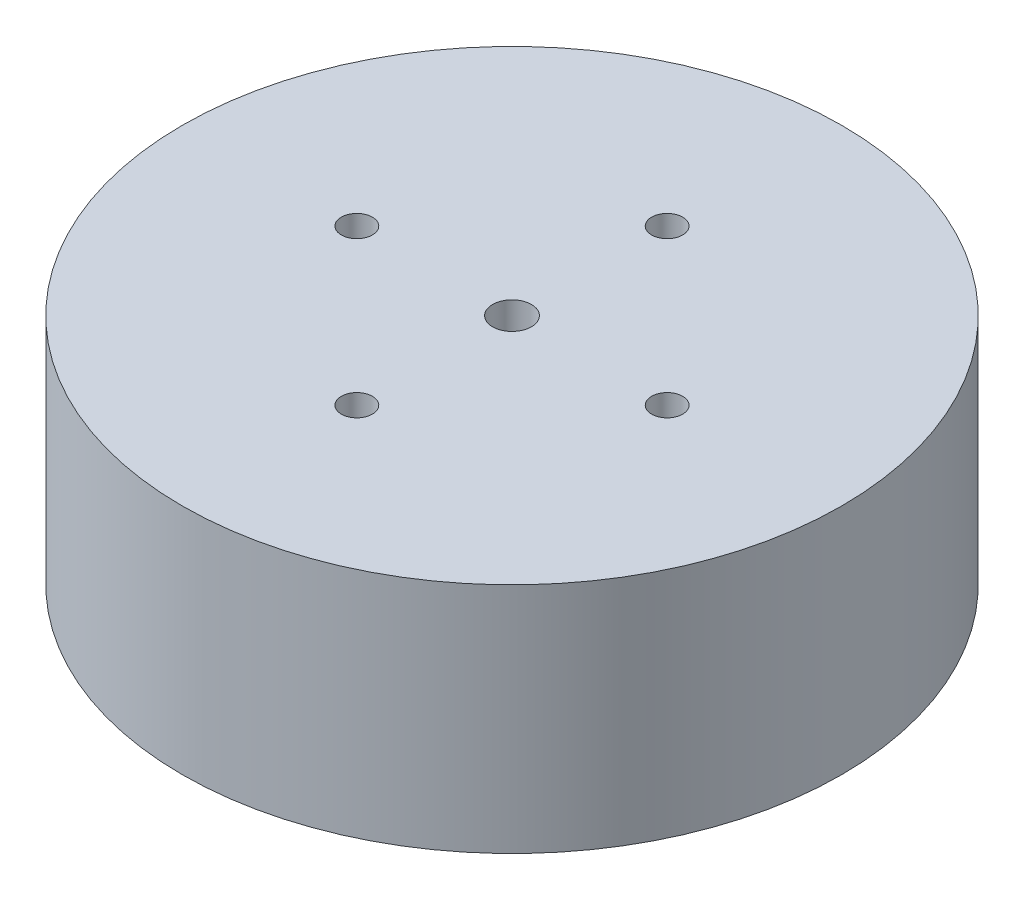
from build123d import *

# Parameters (mm, degrees)
CROQUIS1_R              = 42.5
SALIENTE_EXTRUIR1_DEPTH = 30
CROQUIS2_R              = 2.5
CORTAR_EXTRUIR1_DEPTH   = 10
CROQUIS3_R              = 27.5
CORTAR_EXTRUIR2_DEPTH   = 5
CROQUIS4_R              = 2
CORTAR_EXTRUIR3_DEPTH   = 66.096082831


with BuildPart() as part:
    # Croquis1 → Saliente-Extruir1 (new body)
    with BuildSketch(Plane(origin=(0, 0, 0), x_dir=(1, 0, 0), z_dir=(0, 1, 0))):
        with Locations(Location((0, 0, 0), (0, 0, 270))):
            Circle(CROQUIS1_R)
    extrude(amount=SALIENTE_EXTRUIR1_DEPTH)

    # Croquis2 → Cortar-Extruir1 (cut)
    with BuildSketch(Plane(origin=(0, 30, 0), x_dir=(1, 0, 0), z_dir=(0, 1, 0))):
        with Locations(Location((0, 0, 0), (0, 0, 270))):
            Circle(CROQUIS2_R)
    extrude(amount=-CORTAR_EXTRUIR1_DEPTH, mode=Mode.SUBTRACT)

    # Croquis3 → Cortar-Extruir2 (cut)
    with BuildSketch(Plane.XZ):
        with Locations(Location((0, 0, 0), (0, 0, 270))):
            Circle(CROQUIS3_R)
    extrude(amount=-CORTAR_EXTRUIR2_DEPTH, mode=Mode.SUBTRACT)

    # Croquis4 → Cortar-Extruir3 (cut, through all)
    with BuildSketch(Plane.XZ.offset(-5)):
        with Locations(Location((0, 20, 0), (0, 0, 270))):
            Circle(CROQUIS4_R)
        with Locations(Location((-20, 0, 0), (0, 0, 270))):
            Circle(CROQUIS4_R)
        with Locations(Location((0, -20, 0), (0, 0, 270))):
            Circle(CROQUIS4_R)
        with Locations(Location((20, 0, 0), (0, 0, 270))):
            Circle(CROQUIS4_R)
    extrude(amount=-CORTAR_EXTRUIR3_DEPTH, mode=Mode.SUBTRACT)


solid = part.part
